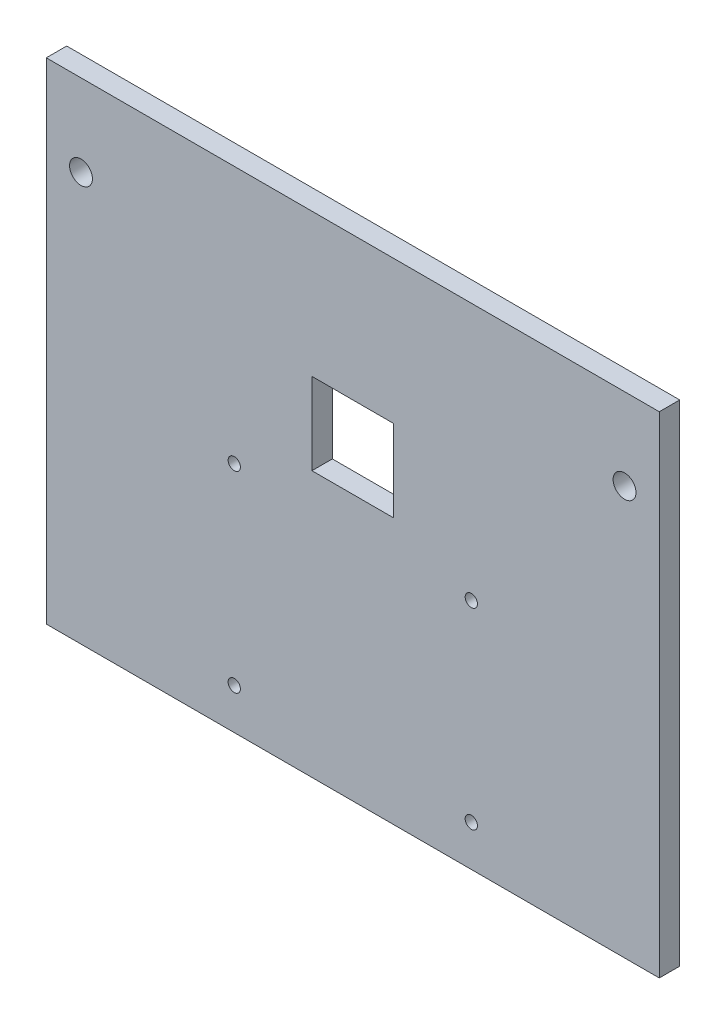
from build123d import *

# Parameters (mm, degrees)
ESQUISSE1_W        = 150
ESQUISSE1_H        = 120
ESQUISSE1_R        = 1.5
ESQUISSE1_R_2      = 2.8
ESQUISSE1_W_2      = 20
ESQUISSE1_H_2      = 20
BOSS_EXTRU_1_DEPTH = 5


with BuildPart() as part:
    # Esquisse1 → Boss.-Extru.1 (new body)
    with BuildSketch(Plane.XY):
        with Locations((75, -60)):
            Rectangle(ESQUISSE1_W, ESQUISSE1_H)
        with Locations((46, -63)):
            Circle(ESQUISSE1_R, mode=Mode.SUBTRACT)
        with Locations((104, -63)):
            Circle(ESQUISSE1_R, mode=Mode.SUBTRACT)
        with Locations((104, -110)):
            Circle(ESQUISSE1_R, mode=Mode.SUBTRACT)
        with Locations((46, -110)):
            Circle(ESQUISSE1_R, mode=Mode.SUBTRACT)
        with Locations((8.5, -20)):
            Circle(ESQUISSE1_R_2, mode=Mode.SUBTRACT)
        with Locations((141.5, -20)):
            Circle(ESQUISSE1_R_2, mode=Mode.SUBTRACT)
        with Locations((75, -45)):
            Rectangle(ESQUISSE1_W_2, ESQUISSE1_H_2, mode=Mode.SUBTRACT)
    extrude(amount=BOSS_EXTRU_1_DEPTH)


solid = part.part
